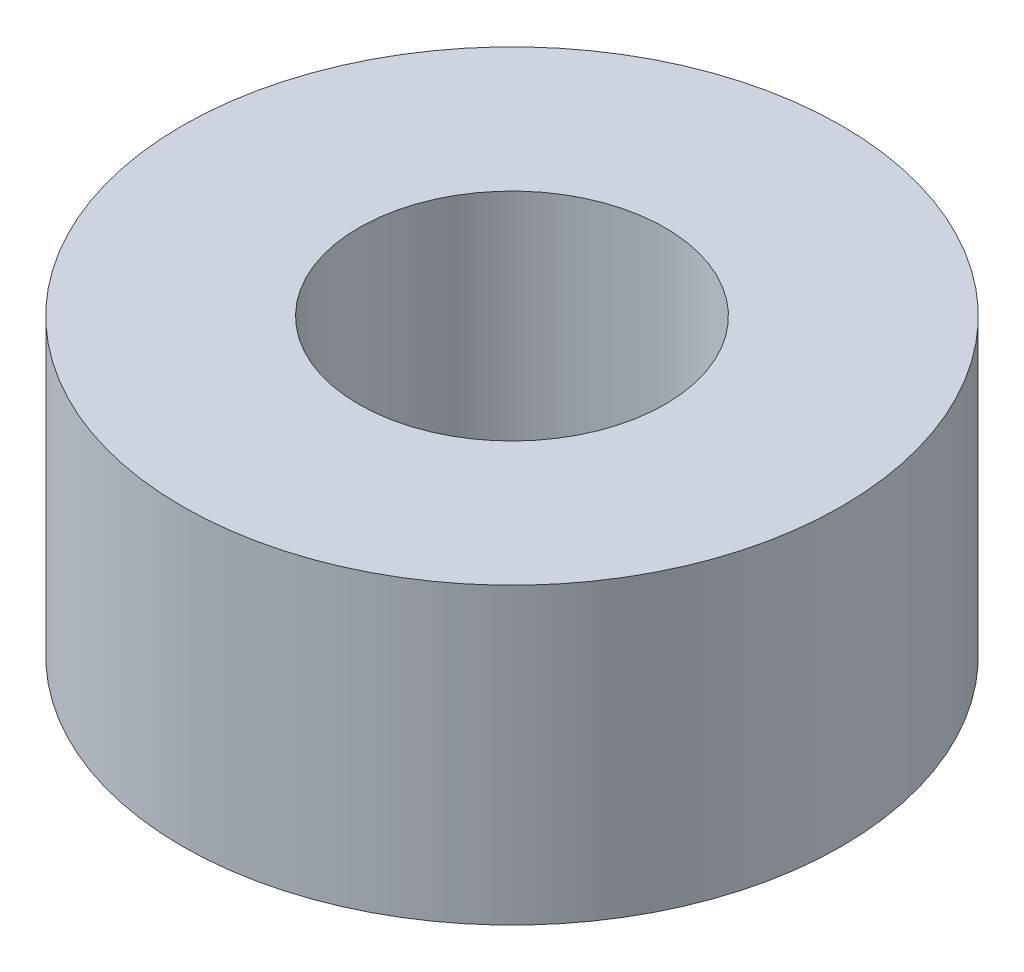
from build123d import *

# Parameters (mm, degrees)
SKETCH1_R           = 5.6
SKETCH1_R_2         = 2.6
BOSS_EXTRUDE1_DEPTH = 5


with BuildPart() as part:
    # Sketch1 → Boss-Extrude1 (new body)
    with BuildSketch(Plane(origin=(0, 0, 0), x_dir=(1, 0, 0), z_dir=(0, 1, 0))):
        with Locations(Location((0, 0, 0), (0, 0, 270))):
            Circle(SKETCH1_R)
        with Locations(Location((0, 0, 0), (0, 0, 270))):
            Circle(SKETCH1_R_2, mode=Mode.SUBTRACT)
    extrude(amount=BOSS_EXTRUDE1_DEPTH)


solid = part.part
